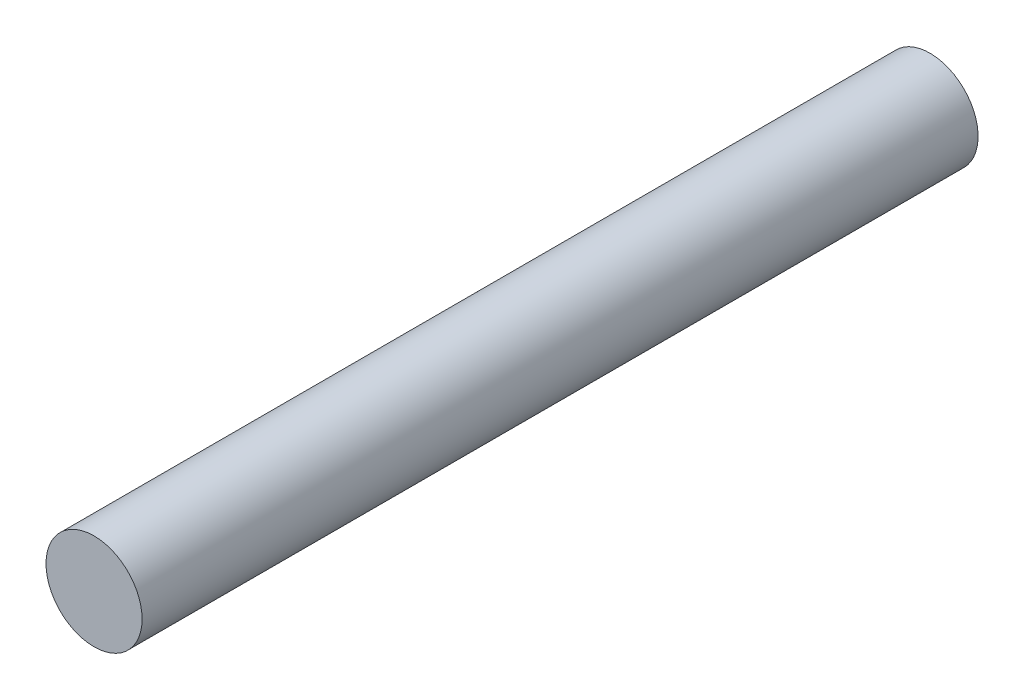
from build123d import *

# Parameters (mm, degrees)
SKETCH1_R           = 3
BOSS_EXTRUDE1_DEPTH = 50
CUT_EXTRUDE1_START  = -27.65
SKETCH2_R           = 3
CUT_EXTRUDE1_DEPTH  = 27.65
CUT_EXTRUDE2_START  = -20.15
SKETCH3_R           = 3
CUT_EXTRUDE2_DEPTH  = 20.15


with BuildPart() as part:
    # Sketch1 → Boss-Extrude1 (new, symmetric)
    with BuildSketch(Plane.XY):
        Circle(SKETCH1_R)
    extrude(amount=BOSS_EXTRUDE1_DEPTH, both=True)

    # Sketch2 → Cut-Extrude1 (cut)
    with BuildSketch(Plane.XY.offset(50).offset(CUT_EXTRUDE1_START)):
        Circle(SKETCH2_R)
    extrude(amount=CUT_EXTRUDE1_DEPTH, mode=Mode.SUBTRACT)

    # Sketch3 → Cut-Extrude2 (cut)
    with BuildSketch(Plane(origin=(0, 0, -50), x_dir=(-1, 0, 0), z_dir=(0, 0, -1)).offset(CUT_EXTRUDE2_START)):
        Circle(SKETCH3_R)
    extrude(amount=CUT_EXTRUDE2_DEPTH, mode=Mode.SUBTRACT)


solid = part.part
